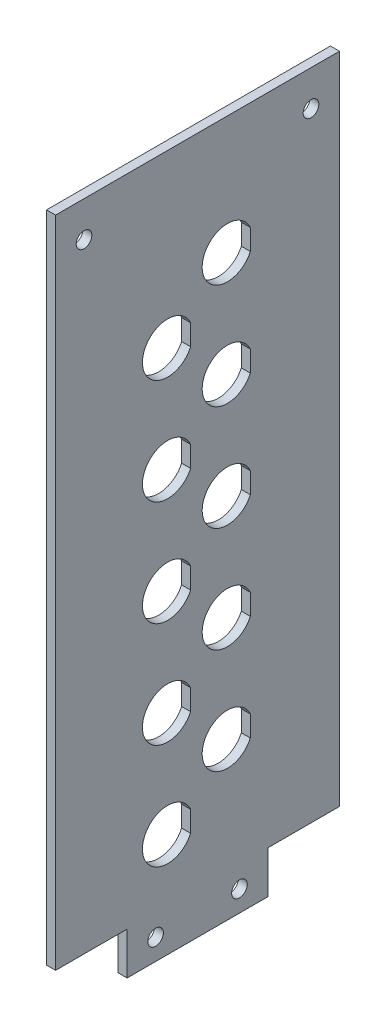
from build123d import *

# Parameters (mm, degrees)
SKETCH1_W           = 14.9
SKETCH1_H           = 49.5
SKETCH1_R           = 2.75
SKETCH1_W_2         = 230
SKETCH1_H_2         = 99.8
BOSS_EXTRUDE1_DEPTH = 3.175
CUT_EXTRUDE1_DEPTH  = 140.190878383


with BuildPart() as part:
    # Sketch1 → Boss-Extrude1 (new body)
    # profile 1 of 2: a face of its own
    with BuildSketch(Plane.YZ):
        with Locations((-122.45, 0)):
            Rectangle(SKETCH1_W, SKETCH1_H)
        with Locations(Location((-122.5, -14.75, 0), (0, 0, 270))):
            Circle(SKETCH1_R, mode=Mode.SUBTRACT)
        with Locations(Location((-122.5, 14.75, 0), (0, 0, 270))):
            Circle(SKETCH1_R, mode=Mode.SUBTRACT)
    # profile 2 of 2: a face of its own
    with BuildSketch(Plane.YZ):
        Rectangle(SKETCH1_W_2, SKETCH1_H_2)
        with Locations(Location((102.5, -39.9, 0), (0, 0, 270))):
            Circle(SKETCH1_R, mode=Mode.SUBTRACT)
        with Locations(Location((102.5, 39.9, 0), (0, 0, 270))):
            Circle(SKETCH1_R, mode=Mode.SUBTRACT)
    extrude(amount=BOSS_EXTRUDE1_DEPTH)

    # Sketch2 → Cut-Extrude1 (cut, through all)
    with BuildSketch(Plane.YZ.offset(3.175)):
        with BuildLine():
            Line((51.1685143, 2.4228), (58.473299942, 2.4228))
            ThreePointArc((58.473299942, 2.4228), (54.820907121, 19.3646), (51.1685143, 2.4228))
        make_face()
        with BuildLine():
            Line((69.688773477, -18.5772), (76.99355912, -18.5772))
            ThreePointArc((76.99355912, -18.5772), (73.341166299, -1.6354), (69.688773477, -18.5772))
        make_face()
        with BuildLine():
            Line((14.127995945, 2.4228), (21.432781587, 2.4228))
            ThreePointArc((21.432781587, 2.4228), (17.780388766, 19.3646), (14.127995945, 2.4228))
        make_face()
        with BuildLine():
            Line((32.648255122, -18.5772), (39.953040765, -18.5772))
            ThreePointArc((39.953040765, -18.5772), (36.300647944, -1.6354), (32.648255122, -18.5772))
        make_face()
        with BuildLine():
            Line((-22.91252241, 2.4228), (-15.607736768, 2.4228))
            ThreePointArc((-15.607736768, 2.4228), (-19.260129589, 19.3646), (-22.91252241, 2.4228))
        make_face()
        with BuildLine():
            Line((-4.392263232, -18.5772), (2.91252241, -18.5772))
            ThreePointArc((2.91252241, -18.5772), (-0.739870411, -1.6354), (-4.392263232, -18.5772))
        make_face()
        with BuildLine():
            Line((-59.953040765, 2.4228), (-52.648255122, 2.4228))
            ThreePointArc((-52.648255122, 2.4228), (-56.300647944, 19.3646), (-59.953040765, 2.4228))
        make_face()
        with BuildLine():
            Line((-41.432781587, -18.5772), (-34.127995945, -18.5772))
            ThreePointArc((-34.127995945, -18.5772), (-37.780388766, -1.6354), (-41.432781587, -18.5772))
        make_face()
        with BuildLine():
            Line((-96.99355912, 2.4228), (-89.688773477, 2.4228))
            ThreePointArc((-89.688773477, 2.4228), (-93.341166299, 19.3646), (-96.99355912, 2.4228))
        make_face()
        with BuildLine():
            Line((-78.473299942, -18.5772), (-71.1685143, -18.5772))
            ThreePointArc((-71.1685143, -18.5772), (-74.820907121, -1.6354), (-78.473299942, -18.5772))
        make_face()
    extrude(amount=-CUT_EXTRUDE1_DEPTH, mode=Mode.SUBTRACT)


solid = part.part
